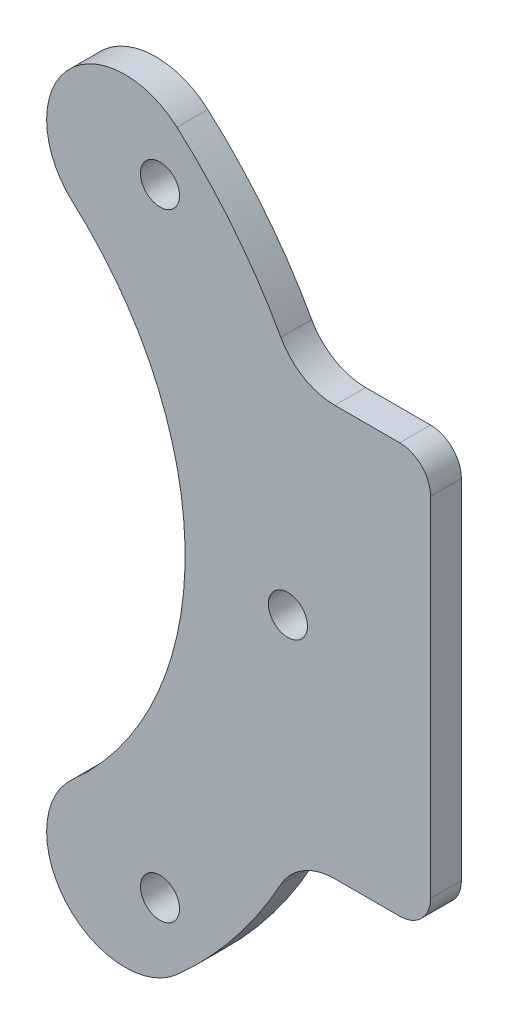
from build123d import *

# Parameters (mm, degrees)
SKETCH_1_R          = 47.75
SKETCH_1_R_2        = 32.5
SKETCH_1_R_3        = 1.9
EXTRUDE_1_DEPTH     = 3
SKETCH_2_R          = 1.9
CUT_EXTRUDE_1_DEPTH = 3
EXTRUDE_2_DEPTH     = 3
FILLET_1_R          = 3
FILLET_2_R          = 6


with BuildPart() as part:
    # 草图1 → 凸台-拉伸1 (new body)
    with BuildSketch(Plane.XY):
        Circle(SKETCH_1_R)
        Circle(SKETCH_1_R_2, mode=Mode.SUBTRACT)
        with Locations((0, 42.5)):
            Circle(SKETCH_1_R_3, mode=Mode.SUBTRACT)
        with Locations((30.0520382, 30.0520382)):
            Circle(SKETCH_1_R_3, mode=Mode.SUBTRACT)
        with Locations((42.5, 0)):
            Circle(SKETCH_1_R_3, mode=Mode.SUBTRACT)
        with Locations((30.0520382, -30.0520382)):
            Circle(SKETCH_1_R_3, mode=Mode.SUBTRACT)
        with Locations((0, -42.5)):
            Circle(SKETCH_1_R_3, mode=Mode.SUBTRACT)
        with Locations((-30.0520382, -30.0520382)):
            Circle(SKETCH_1_R_3, mode=Mode.SUBTRACT)
        with Locations((-42.5, 0)):
            Circle(SKETCH_1_R_3, mode=Mode.SUBTRACT)
        with Locations((-30.0520382, 30.0520382)):
            Circle(SKETCH_1_R_3, mode=Mode.SUBTRACT)
    extrude(amount=EXTRUDE_1_DEPTH)

    # 草图2 → 切除-拉伸1 (cut)
    # profile 1 of 2: a face of its own
    with BuildSketch(Plane(origin=(0, 0, 0), x_dir=(-1, 0, 0), z_dir=(0, 0, -1))):
        with BuildLine():
            ThreePointArc((40.6, 0), (42.5, 1.9), (44.4, 0))
            Line((44.4, 0), (47.75, 0))
            ThreePointArc((47.75, 0), (19.569412493, 43.555718278), (-31.709710772, 35.700934761))
            ThreePointArc((-31.709710772, 35.700934761), (-23.521159741, 36.955232453), (-19.021118385, 30))
            ThreePointArc((-19.021118385, 30), (-19.69088588, 26.875041473), (-21.582525806, 24.29906541))
            ThreePointArc((-21.582525806, 24.29906541), (13.319495322, 29.645253319), (32.5, 0))
            Line((32.5, 0), (40.6, 0))
        make_face()
        with Locations((0, 42.5)):
            Circle(SKETCH_2_R, mode=Mode.SUBTRACT)
        with Locations((30.0520382, 30.0520382)):
            Circle(SKETCH_2_R, mode=Mode.SUBTRACT)
    # profile 2 of 2: a face of its own
    with BuildSketch(Plane(origin=(0, 0, 0), x_dir=(-1, 0, 0), z_dir=(0, 0, -1))):
        with BuildLine():
            Line((47.75, 0), (44.4, 0))
            ThreePointArc((44.4, 0), (42.5, -1.9), (40.6, 0))
            Line((40.6, 0), (32.5, 0))
            ThreePointArc((32.5, 0), (13.319495418, -29.645253276), (-21.582525651, -24.299065549))
            ThreePointArc((-21.582525651, -24.299065549), (-19.690885837, -26.875041568), (-19.021118385, -30))
            ThreePointArc((-19.021118385, -30), (-23.521159897, -36.955232523), (-31.709711027, -35.700934534))
            ThreePointArc((-31.709711027, -35.700934534), (19.569412338, -43.555718347), (47.75, 0))
        make_face()
        with Locations((0, -42.5)):
            Circle(SKETCH_2_R, mode=Mode.SUBTRACT)
        with Locations((30.0520382, -30.0520382)):
            Circle(SKETCH_2_R, mode=Mode.SUBTRACT)
    extrude(amount=-CUT_EXTRUDE_1_DEPTH, mode=Mode.SUBTRACT)

    # 草图3 → 凸台-拉伸2 (add)
    with BuildSketch(Plane(origin=(0, 0, 0), x_dir=(-1, 0, 0), z_dir=(0, 0, -1))):
        with BuildLine():
            Line((-43.382715452, 19.95), (-56.382715452, 19.95))
            Line((-56.382715452, 19.95), (-56.382715452, 0))
            Line((-56.382715452, 0), (-47.75, 0))
            ThreePointArc((-47.75, 0), (-46.645402575, 10.211215333), (-43.382715452, 19.95))
        make_face()
        with BuildLine():
            Line((-47.75, 0), (-56.382715452, 0))
            Line((-56.382715452, 0), (-56.382715452, -19.95))
            Line((-56.382715452, -19.95), (-43.382715452, -19.95))
            ThreePointArc((-43.382715452, -19.95), (-46.645402575, -10.211215333), (-47.75, 0))
        make_face()
    extrude(amount=-EXTRUDE_2_DEPTH)

    # 圆角1
    fillet_1_edges = [part.edges().sort_by_distance(p)[0] for p in [
        (56.382715452, -19.95, 1.5),
        (56.382715452, 19.95, 1.5),
    ]]
    fillet(fillet_1_edges, radius=FILLET_1_R)

    # 圆角2
    fillet_2_edges = [part.edges().sort_by_distance(p)[0] for p in [
        (43.382715452, 19.95, 1.5),
        (43.382715452, -19.95, 1.5),
    ]]
    fillet(fillet_2_edges, radius=FILLET_2_R)


solid = part.part
